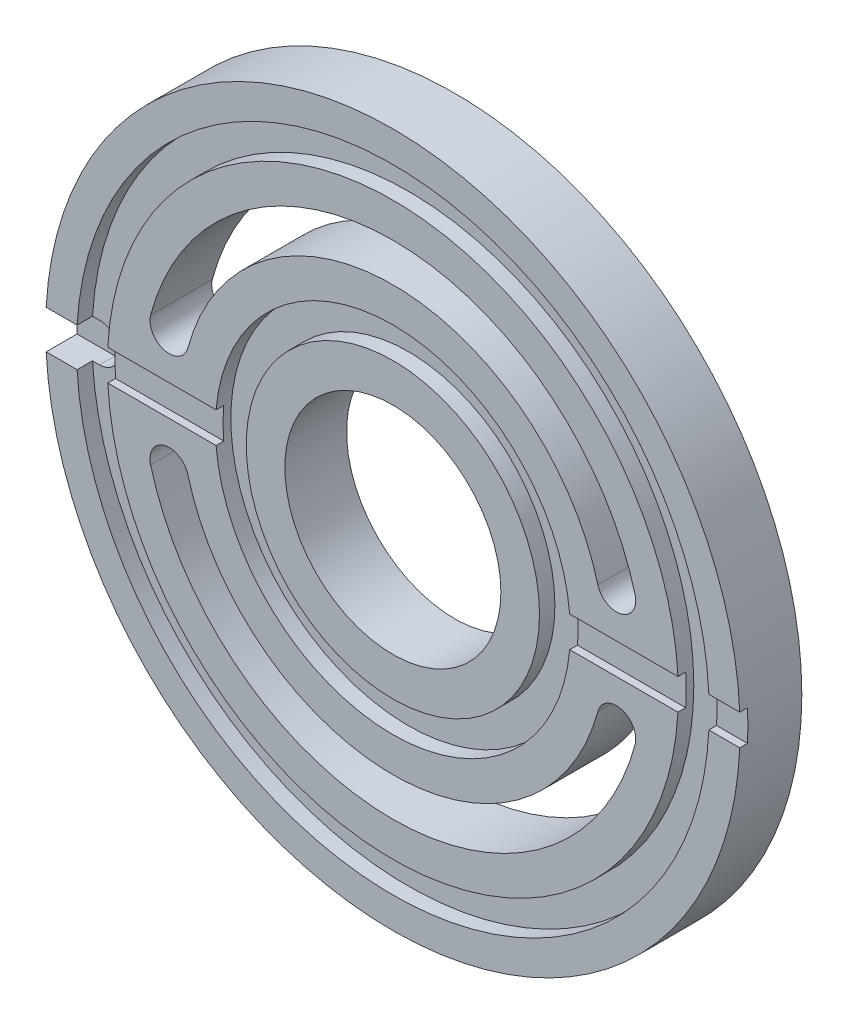
from build123d import *

# Parameters (mm, degrees)
SKETCH_1_R            = 45
EXTRUDE_1_DEPTH       = 8
SKETCH_2_R            = 14
CUT_EXTRUDE_1_DEPTH   = 65.140470843
SKETCH_3_R            = 41
SKETCH_3_R_2          = 37
CUT_EXTRUDE_1_2_DEPTH = 2
CUT_EXTRUDE_2_DEPTH   = 4
CUT_EXTRUDE_3_DEPTH   = 65.140470843
SKETCH_6_R            = 23
SKETCH_6_R_2          = 19
CUT_EXTRUDE_2_2_DEPTH = 2
SKETCH_7_W            = 18
SKETCH_7_H            = 4
SKETCH_7_W_2          = 26
CUT_EXTRUDE_3_2_DEPTH = 1


with BuildPart() as part:
    # 草图1 → 凸台-拉伸1 (new body)
    with BuildSketch(Plane.XY):
        Circle(SKETCH_1_R)
    extrude(amount=EXTRUDE_1_DEPTH)

    # 草图2 → Cut-Extrude 1 (cut, through all)
    with BuildSketch(Plane.XY.offset(8)):
        Circle(SKETCH_2_R)
    extrude(amount=-CUT_EXTRUDE_1_DEPTH, mode=Mode.SUBTRACT)

    # 草图3 → Cut-Extrude 1 2 (cut)
    with BuildSketch(Plane.XY.offset(8)):
        Circle(SKETCH_3_R)
        Circle(SKETCH_3_R_2, mode=Mode.SUBTRACT)
    extrude(amount=-CUT_EXTRUDE_1_2_DEPTH, mode=Mode.SUBTRACT)

    # 草图4 → Cut-Extrude 2 (cut)
    with BuildSketch(Plane.XY.offset(8)):
        with BuildLine():
            Line((-45, 2.5), (-40, 2.5))
            ThreePointArc((-40, 2.5), (-37.5, 0), (-40, -2.5))
            Line((-40, -2.5), (-45, -2.5))
            ThreePointArc((-45, -2.5), (-47.5, 0), (-45, 2.5))
        make_face()
    extrude(amount=-CUT_EXTRUDE_2_DEPTH, mode=Mode.SUBTRACT)

    # 草图5 → Cut-Extrude 3 (cut, through all)
    with BuildSketch(Plane.XY.offset(8)):
        with BuildLine():
            ThreePointArc((31.392589354, 8.411618966), (0, 32.5), (-31.392589354, 8.411618966))
            ThreePointArc((-31.392589354, 8.411618966), (-29.624822401, 5.349756787), (-26.562960223, 7.11752374))
            ThreePointArc((-26.562960223, 7.11752374), (0, 27.5), (26.562960223, 7.11752374))
            ThreePointArc((26.562960223, 7.11752374), (29.624822401, 5.349756787), (31.392589354, 8.411618966))
        make_face()
    cut_extrude_3 = extrude(amount=-CUT_EXTRUDE_3_DEPTH, mode=Mode.SUBTRACT)

    # 镜向1: Cut-Extrude 3 across plane
    add(cut_extrude_3.mirror(Plane.ZX), mode=Mode.SUBTRACT)

    # 草图6 → Cut-Extrude 2 2 (cut)
    with BuildSketch(Plane.XY.offset(8)):
        Circle(SKETCH_6_R)
        Circle(SKETCH_6_R_2, mode=Mode.SUBTRACT)
    extrude(amount=-CUT_EXTRUDE_2_2_DEPTH, mode=Mode.SUBTRACT)

    # 草图7 → Cut-Extrude 3 2 (cut)
    with BuildSketch(Plane.XY.offset(8)):
        with Locations((-28, 0)):
            Rectangle(SKETCH_7_W, SKETCH_7_H)
        with Locations((32, 0)):
            Rectangle(SKETCH_7_W_2, SKETCH_7_H)
    extrude(amount=-CUT_EXTRUDE_3_2_DEPTH, mode=Mode.SUBTRACT)


solid = part.part
